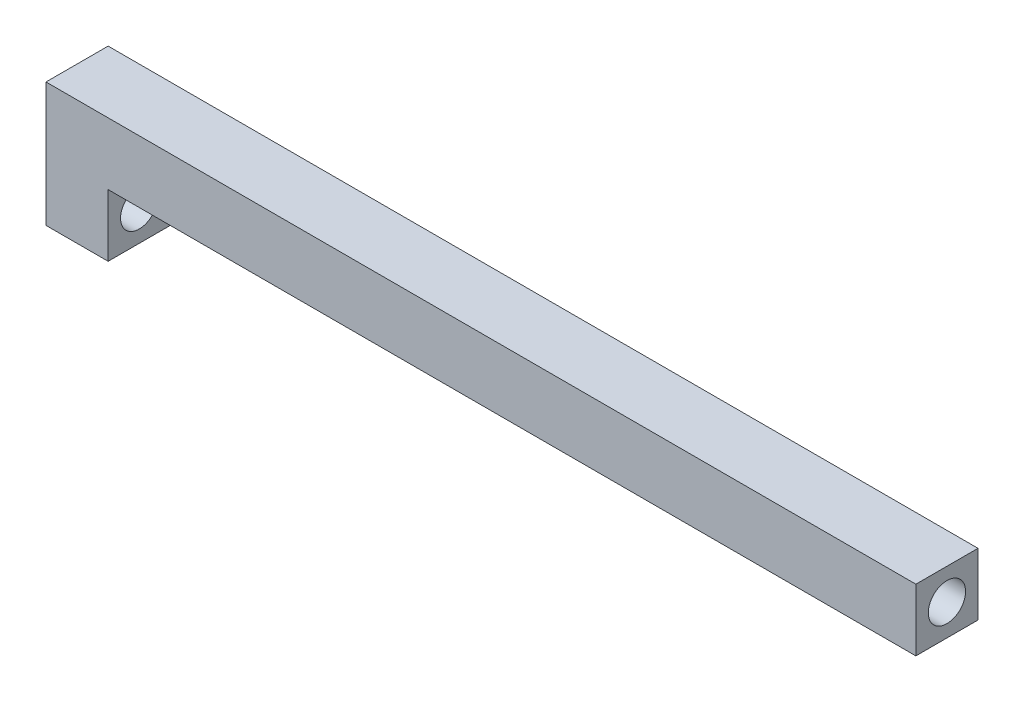
from build123d import *

# Parameters (mm, degrees)
BOSS_EXTRUDE1_DEPTH = 10
SKETCH4_R           = 3
CUT_EXTRUDE2_DEPTH  = 150
SKETCH4_3_R         = 3
CUT_EXTRUDE3_DEPTH  = 20


with BuildPart() as part:
    # Sketch1 → Boss-Extrude1 (new body)
    with BuildSketch(Plane.XY):
        Polygon((-140, 10), (0, 10), (0, 0), (-130, 0), (-130, -10), (-140, -10), align=None)
    extrude(amount=BOSS_EXTRUDE1_DEPTH)

    # Sketch4 → Cut-Extrude2 (cut)
    with BuildSketch(Plane(origin=(0, 0, 0), x_dir=(0, 0, -1), z_dir=(1, 0, 0))):
        with Locations((-5, -5)):
            Circle(SKETCH4_R)
    extrude(amount=-CUT_EXTRUDE2_DEPTH, mode=Mode.SUBTRACT)

    # Sketch4<3> → Cut-Extrude3 (cut)
    with BuildSketch(Plane(origin=(0, 0, 0), x_dir=(0, 0, -1), z_dir=(1, 0, 0))):
        with Locations((-5, 5)):
            Circle(SKETCH4_3_R)
    extrude(amount=-CUT_EXTRUDE3_DEPTH, mode=Mode.SUBTRACT)


solid = part.part
